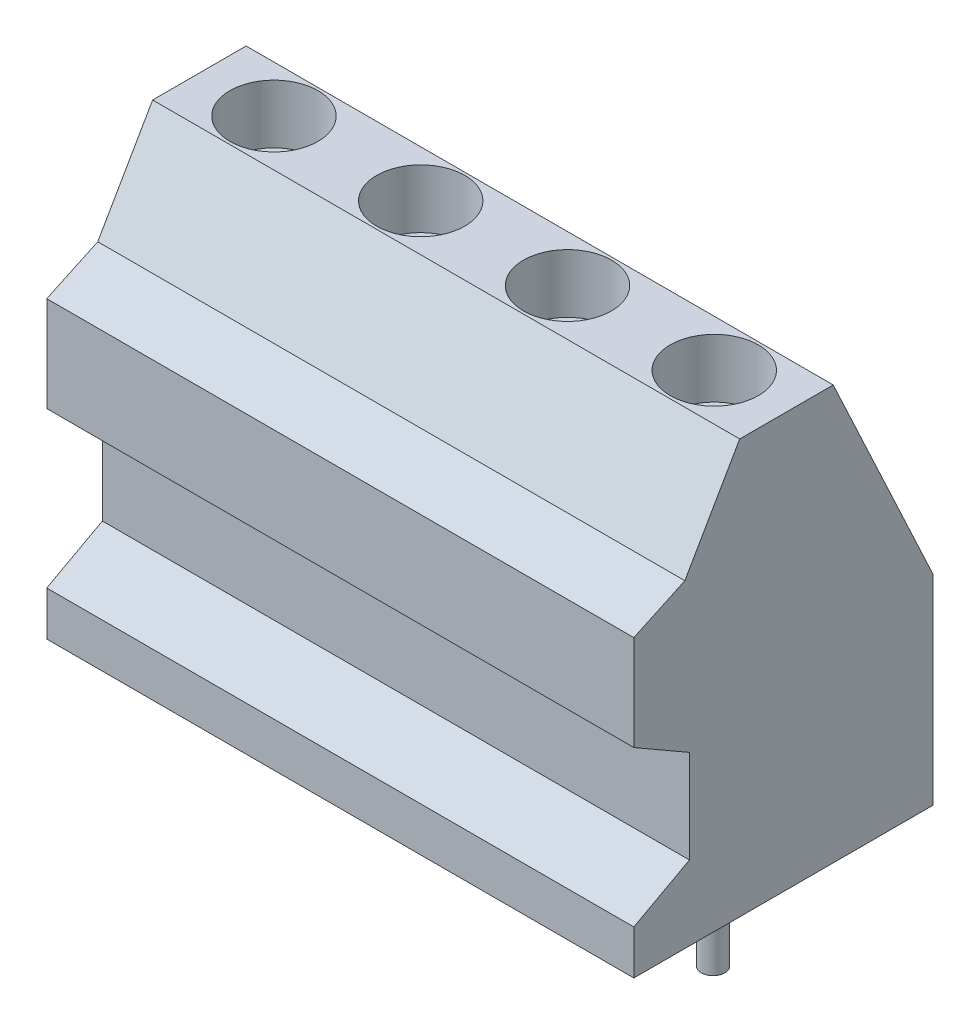
from build123d import *

# Parameters (mm, degrees)
EXTRUDE_1_DEPTH     = 20
SKETCH_2_R          = 1.5
CUT_EXTRUDE_1_DEPTH = 2
SKETCH_3_R          = 0.4
EXTRUDE_2_DEPTH     = 3.5


with BuildPart() as part:
    # 草图1 → 凸台-拉伸1 (new body)
    with BuildSketch(Plane(origin=(0, 0, 0), x_dir=(0, 0, -1), z_dir=(1, 0, 0))):
        Polygon((0, 0), (5, 0), (5, 6.798949449), (1.592861235, 14.1), (-1.592861235, 14.1), (-3.462246636, 10.852770352), (-5.2, 10.041823104), (-5.2, 6.798949449), (-3.305827132, 5.708500208), (-3.305827132, 2.534594125), (-5.2, 1.506142854), (-5.2, 0), align=None)
    extrude(amount=EXTRUDE_1_DEPTH)

    # 草图2 → 切除-拉伸1 (cut)
    with BuildSketch(Plane(origin=(0, 14.1, 0), x_dir=(1, 0, 0), z_dir=(0, 1, 0))):
        with Locations(Location((2.54, 0, 0), (0, 0, 270))):
            Circle(SKETCH_2_R)
        with Locations(Location((7.54, 0, 0), (0, 0, 270))):
            Circle(SKETCH_2_R)
        with Locations(Location((12.54, 0, 0), (0, 0, 270))):
            Circle(SKETCH_2_R)
        with Locations(Location((17.54, 0, 0), (0, 0, 270))):
            Circle(SKETCH_2_R)
    extrude(amount=-CUT_EXTRUDE_1_DEPTH, mode=Mode.SUBTRACT)

    # 草图3 → 凸台-拉伸2 (add)
    with BuildSketch(Plane.XZ):
        with Locations(Location((2.5, 0, 0), (0, 0, 90))):
            Circle(SKETCH_3_R)
        with Locations(Location((7.5, 0, 0), (0, 0, 90))):
            Circle(SKETCH_3_R)
        with Locations(Location((12.5, 0, 0), (0, 0, 90))):
            Circle(SKETCH_3_R)
        with Locations(Location((17.5, 0, 0), (0, 0, 90))):
            Circle(SKETCH_3_R)
    extrude(amount=EXTRUDE_2_DEPTH)


solid = part.part
